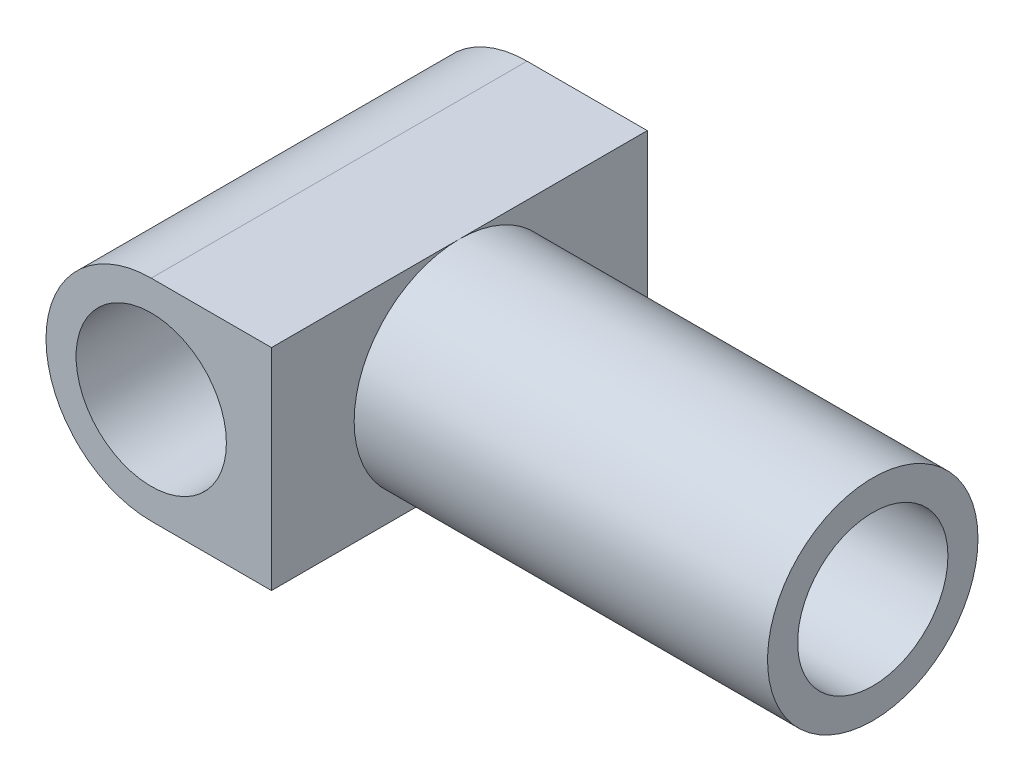
from build123d import *

# Parameters (mm, degrees)
SZKIC1_R                    = 5
DODANIE_WYCI_GNI_CIE1_DEPTH = 25
SZKIC2_R                    = 7
SZKIC2_R_2                  = 5
DODANIE_WYCI_GNI_CIE2_DEPTH = 27.5


with BuildPart() as part:
    # Szkic1 → Dodanie-wyciągnięcie1 (new body)
    with BuildSketch(Plane.XY):
        with BuildLine():
            Line((0, 7), (8, 7))
            Line((8, 7), (8, -7))
            Line((8, -7), (0, -7))
            ThreePointArc((0, -7), (-7, 0), (0, 7))
        make_face()
        Circle(SZKIC1_R, mode=Mode.SUBTRACT)
    extrude(amount=DODANIE_WYCI_GNI_CIE1_DEPTH)

    # Szkic2 → Dodanie-wyciągnięcie2 (add)
    with BuildSketch(Plane(origin=(8, 0, 0), x_dir=(0, 0, -1), z_dir=(1, 0, 0))):
        with Locations(Location((-12.5, 0, 0), (0, 0, 270))):
            Circle(SZKIC2_R)
        with Locations((-12.5, 0)):
            Circle(SZKIC2_R_2, mode=Mode.SUBTRACT)
    extrude(amount=DODANIE_WYCI_GNI_CIE2_DEPTH)


solid = part.part
